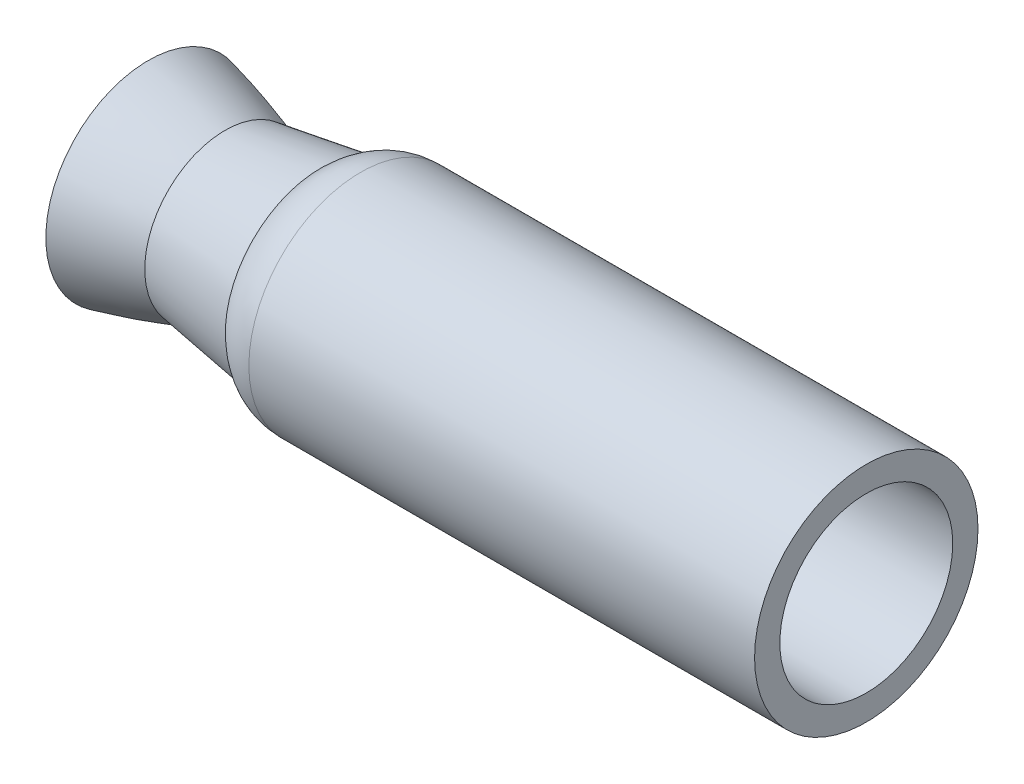
from build123d import *


with BuildPart() as part:
    # Sketch1 → Revolve1 (revolve)
    with BuildSketch(Plane.XY, mode=Mode.PRIVATE) as revolve1_sk:
        with BuildLine():
            Line((28.949236933, 27.386004017), (189.133015331, 27.386004017))
            Line((189.133015331, 27.386004017), (189.133015331, 35.386004017))
            Line((189.133015331, 35.386004017), (28.949236933, 35.386004017))
            ThreePointArc((28.949236933, 35.386004017), (22.060935151, 34.015835602), (16.221314872, 30.113926078))
            Line((16.221314872, 30.113926078), (7.884849119, 21.777460326))
            ThreePointArc((7.884849119, 21.777460326), (5.344435892, 20.007381854), (2.348184674, 19.226769399))
            add(Edge.make_bspline(
                [(2.348184674, 19.226769399), (0.313545637, 20.077506039), (-5.800272609, 22.518234313), (-11.933859149, 24.735791909), (-13.981586934, 25.437652311)],
                knots=[0.018493807, 0.018493807, 0.018493807, 0.117487589, 0.315475154, 0.414468937, 0.414468937, 0.414468937], degree=2))
            add(Edge.make_bspline(
                [(-13.981586934, 25.437652311), (-16.029314719, 26.139512712), (-28.160190772, 30.070121673), (-38.315022829, 32.432092239)],
                knots=[0.414468937, 0.414468937, 0.414468937, 0.513462719, 1, 1, 1], degree=2))
            Line((-38.315022829, 32.432092239), (-40.127010283, 24.64))
            add(Edge.make_bspline(
                [(0, 11.536137468), (-19.948257354, 19.947595697), (-40.127010283, 24.64)],
                knots=[0, 0, 0, 1, 1, 1], degree=2))
            ThreePointArc((0, 11.536137468), (0.81433228, 11.284876268), (1.662309445, 11.2))
            ThreePointArc((1.662309445, 11.2), (8.091391109, 12.478823854), (13.541703369, 16.120606076))
            Line((13.541703369, 16.120606076), (21.878169121, 24.457071829))
            ThreePointArc((21.878169121, 24.457071829), (25.12240261, 26.624799342), (28.949236933, 27.386004017))
        make_face()
        with BuildLine():
            Line((7.884849119, 21.777460326), (16.221314872, 30.113926078))
            Line((16.221314872, 30.113926078), (-13.981586934, 25.437652311))
            add(Edge.make_bspline(
                [(2.348184674, 19.226769399), (0.313545637, 20.077506039), (-5.800272609, 22.518234313), (-11.933859149, 24.735791909), (-13.981586934, 25.437652311)],
                knots=[0.018493807, 0.018493807, 0.018493807, 0.117487589, 0.315475154, 0.414468937, 0.414468937, 0.414468937], degree=2))
            ThreePointArc((2.348184674, 19.226769399), (5.344435892, 20.007381854), (7.884849119, 21.777460326))
        make_face()
    revolve(revolve1_sk.sketch.rotate(Axis((0, 0, 0), (-1, 0, 0)), 90), axis=Axis((0, 0, 0), (-1, 0, 0)))


solid = part.part
